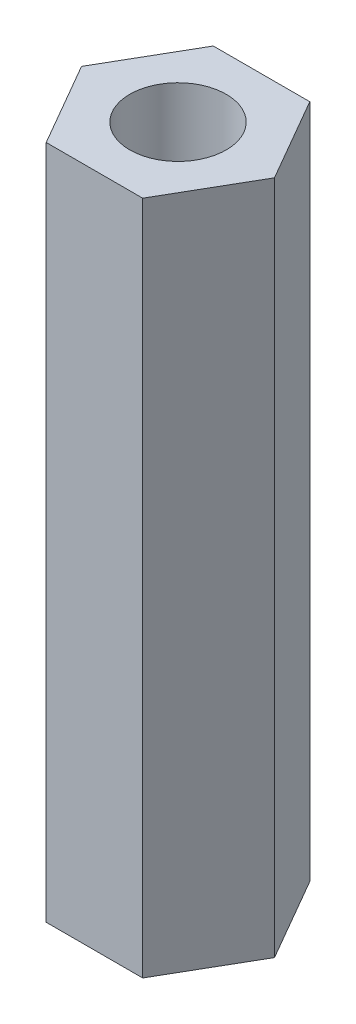
from build123d import *

# Parameters (mm, degrees)
SKETCH1_R           = 2.5
BOSS_EXTRUDE1_DEPTH = 35


with BuildPart() as part:
    # Sketch1 → Boss-Extrude1 (new body)
    with BuildSketch(Plane(origin=(0, 0, 0), x_dir=(1, 0, 0), z_dir=(0, 1, 0))):
        Polygon((-2.5, -4.330127019), (2.5, -4.330127019), (5, 0), (2.5, 4.330127019), (-2.5, 4.330127019), (-5, 0), align=None)
        with Locations(Location((0, 0, 0), (0, 0, 270))):
            Circle(SKETCH1_R, mode=Mode.SUBTRACT)
    extrude(amount=BOSS_EXTRUDE1_DEPTH)


solid = part.part
